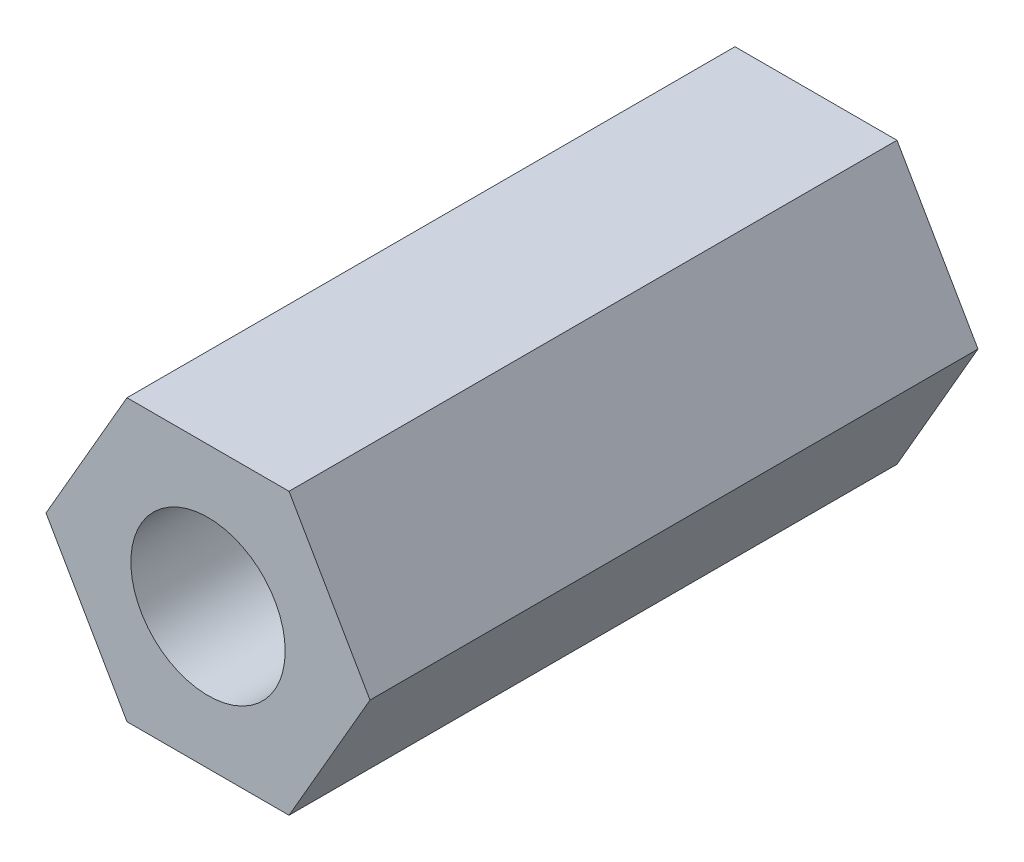
from build123d import *

# Parameters (mm, degrees)
EXTRUDE_1_DEPTH    = 13
HOLE_WIZARD_M4_1_D = 3.3


with BuildPart() as part:
    # 草图1 → 凸台-拉伸1 (new body)
    with BuildSketch(Plane.XY):
        Polygon((0, 0), (3.464101615, 0), (5.196152423, -3), (3.464101615, -6), (0, -6), (-1.732050808, -3), align=None)
    extrude(amount=EXTRUDE_1_DEPTH)

    # M4 螺纹孔1 (through all)
    with Locations(Plane.XY.offset(13)):
        with Locations((1.732050808, -3)):
            Hole(HOLE_WIZARD_M4_1_D / 2)


solid = part.part
